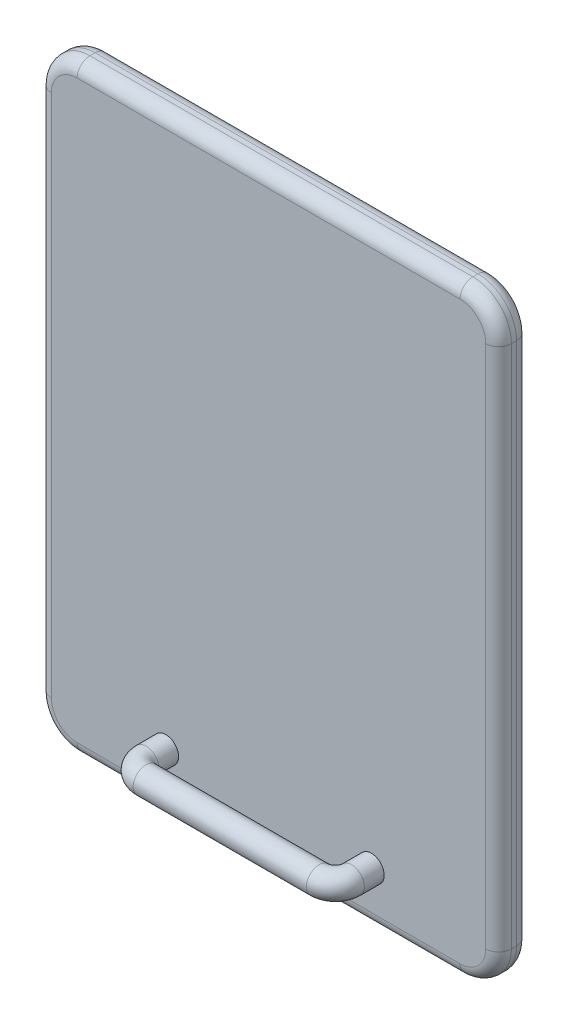
from build123d import *

# Parameters (mm, degrees)
BLOCK_START           = 543
BLOCK_1_DEPTH         = 12
BLOCK_EDGE_FILLET_1_R = 5
PIPE_1_PROFILE_R      = 5


with BuildPart() as part:
    # Block sketch 1 → Block 1 (new body)
    with BuildSketch(Plane.XY.offset(BLOCK_START)):
        with BuildLine():
            Line((683, -117), (832, -117))
            ThreePointArc((832, -117), (842.606601718, -112.606601718), (847, -102))
            Line((847, -102), (847, 102))
            ThreePointArc((847, 102), (842.606601718, 112.606601718), (832, 117))
            Line((832, 117), (683, 117))
            ThreePointArc((683, 117), (672.393398282, 112.606601718), (668, 102))
            Line((668, 102), (668, -102))
            ThreePointArc((668, -102), (672.393398282, -112.606601718), (683, -117))
        make_face()
    extrude(amount=BLOCK_1_DEPTH)

    # Block edge fillet 1
    block_edge_fillet_1_edges = [part.edges().sort_by_distance(p)[0] for p in [
        (672.393398282, -112.606601718, 555),
        (672.393398282, 112.606601718, 555),
        (842.606601718, 112.606601718, 555),
        (842.606601718, -112.606601718, 555),
        (842.606601718, 112.606601718, 543),
        (842.606601718, -112.606601718, 543),
        (757.5, -117, 543),
        (672.393398282, -112.606601718, 543),
        (668, 0, 543),
        (672.393398282, 112.606601718, 543),
        (847, 0, 555),
        (668, 0, 555),
        (757.5, 117, 555),
        (757.5, -117, 555),
        (847, 0, 543),
        (757.5, 117, 543),
    ]]
    fillet(block_edge_fillet_1_edges, radius=BLOCK_EDGE_FILLET_1_R)


with BuildPart() as body_2:
    # Pipe 1: sweep along a curve in space
    with BuildLine() as pipe_1_path:
        Line((717.5, -97, 555), (717.5, -97, 562.7))
        ThreePointArc((717.5, -97, 562.7), (719.345227279, -97, 567.154772721), (723.8, -97, 569))
        Line((723.8, -97, 569), (791.2, -97, 569))
        ThreePointArc((791.2, -97, 569), (795.654772721, -97, 567.154772721), (797.5, -97, 562.7))
        Line((797.5, -97, 562.7), (797.5, -97, 555))
    # Pipe 1 profile (on start of the path) → Pipe 1 (sweep)
    with BuildSketch(Plane(origin=(717.5, -97, 555), x_dir=(1, 0, 0), z_dir=(0, 0, 1))):
        Circle(PIPE_1_PROFILE_R)
    sweep(path=pipe_1_path.line)

    # Combine (weld / assembly of features): union part
    add(part.part)


solid = body_2.part
